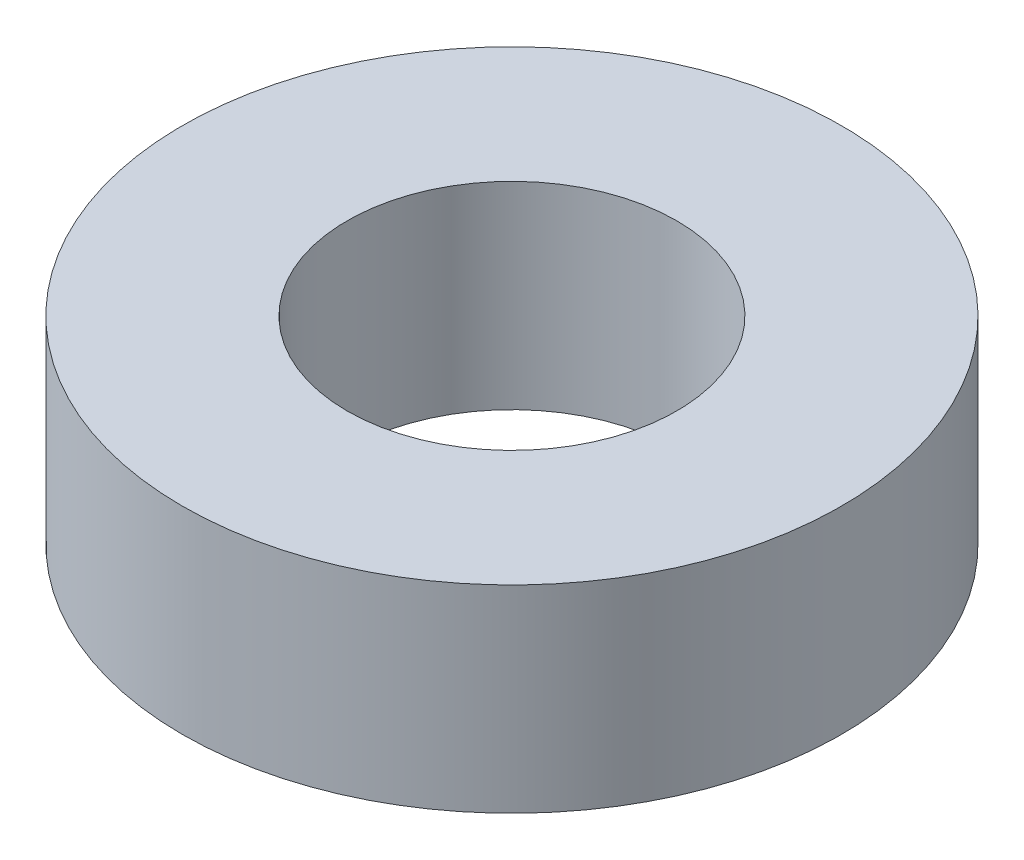
from build123d import *

# Parameters (mm, degrees)
SKETCH1_R           = 5
SKETCH1_R_2         = 2.5
BOSS_EXTRUDE1_DEPTH = 1.5


with BuildPart() as part:
    # Sketch1 → Boss-Extrude1 (new, symmetric)
    with BuildSketch(Plane(origin=(0, 0, 0), x_dir=(1, 0, 0), z_dir=(0, 1, 0))):
        with Locations(Location((0, 0, 0), (0, 0, 270))):
            Circle(SKETCH1_R)
        with Locations(Location((0, 0, 0), (0, 0, 270))):
            Circle(SKETCH1_R_2, mode=Mode.SUBTRACT)
    extrude(amount=BOSS_EXTRUDE1_DEPTH, both=True)


solid = part.part
